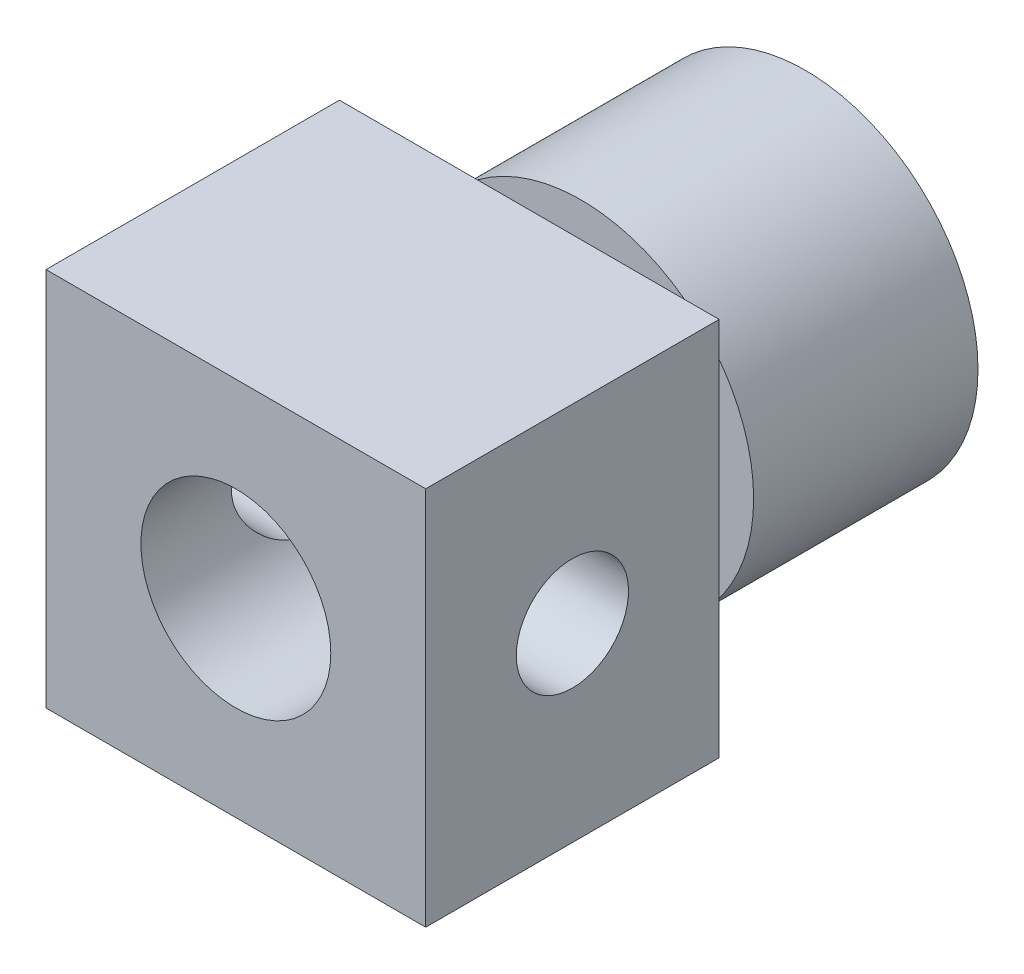
from build123d import *

# Parameters (mm, degrees)
SKETCH1_W           = 22
SKETCH1_H           = 22
BOSS_EXTRUDE1_DEPTH = 17
SKETCH5_R           = 7
BOSS_EXTRUDE4_DEPTH = 3
SKETCH6_R           = 10
BOSS_EXTRUDE5_DEPTH = 13
SKETCH7_R           = 5.5
CUT_EXTRUDE1_DEPTH  = 37.482872694
SKETCH8_R           = 3.25
CUT_EXTRUDE2_DEPTH  = 46.5


with BuildPart() as part:
    # Sketch1 → Boss-Extrude1 (new body)
    with BuildSketch(Plane.XY):
        Rectangle(SKETCH1_W, SKETCH1_H)
    extrude(amount=BOSS_EXTRUDE1_DEPTH)

    # Sketch5 → Boss-Extrude4 (add)
    with BuildSketch(Plane.XY):
        Circle(SKETCH5_R)
    extrude(amount=-BOSS_EXTRUDE4_DEPTH)

    # Sketch6 → Boss-Extrude5 (add)
    with BuildSketch(Plane(origin=(0, 0, -3), x_dir=(-1, 0, 0), z_dir=(0, 0, -1))):
        Circle(SKETCH6_R)
    extrude(amount=BOSS_EXTRUDE5_DEPTH)

    # Sketch7 → Cut-Extrude1 (cut, through all)
    with BuildSketch(Plane.XY.offset(17)):
        Circle(SKETCH7_R)
    extrude(amount=-CUT_EXTRUDE1_DEPTH, mode=Mode.SUBTRACT)

    # Sketch8 → Cut-Extrude2 (cut, symmetric)
    with BuildSketch(Plane(origin=(11, 0, 0), x_dir=(0, 0, -1), z_dir=(1, 0, 0))):
        with Locations(Location((-8.5, 0, 0), (0, 0, 90))):
            Circle(SKETCH8_R)
    extrude(amount=CUT_EXTRUDE2_DEPTH, both=True, mode=Mode.SUBTRACT)


solid = part.part
